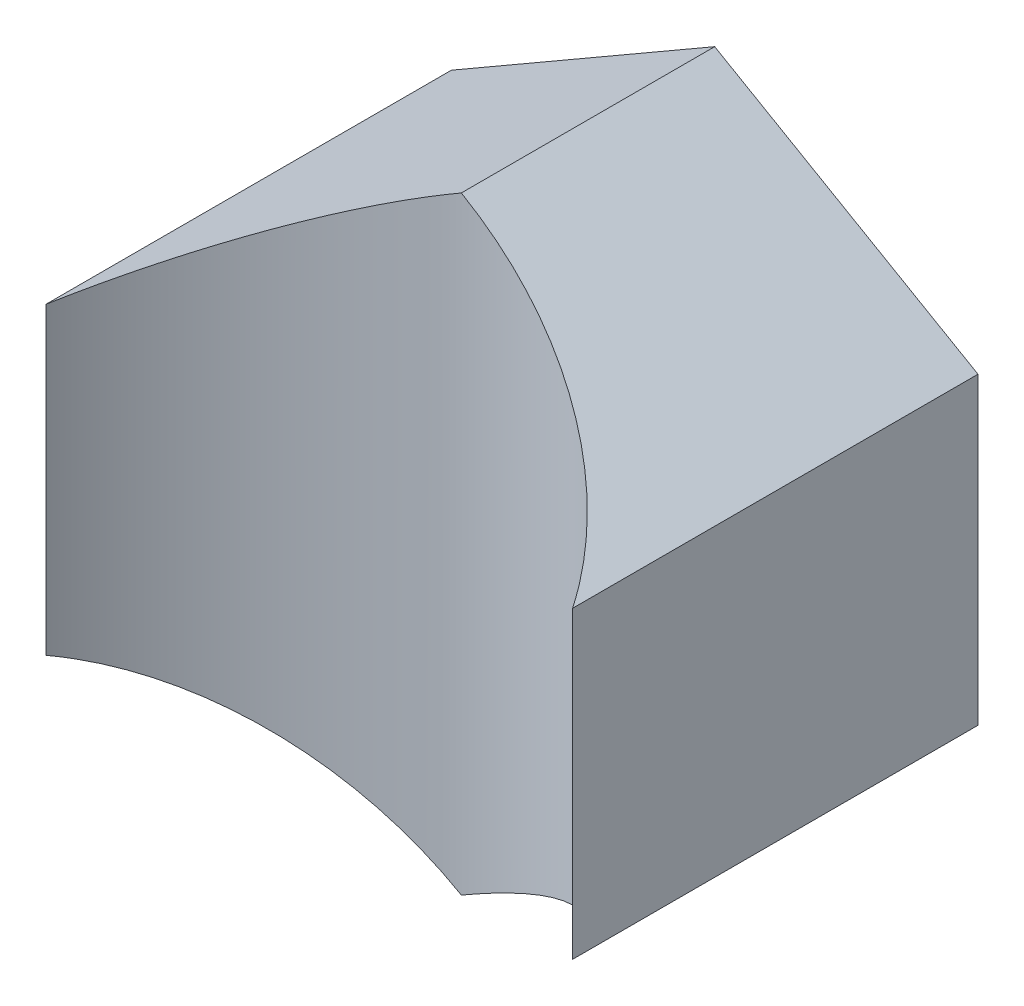
from build123d import *

# Parameters (mm, degrees)
BOSS_EXTRUDE1_DEPTH = 10
SKETCH2_R           = 7.5
CUT_EXTRUDE1_DEPTH  = 13.5


with BuildPart() as part:
    # Sketch1 → Boss-Extrude1 (new body)
    with BuildSketch(Plane.XY):
        Polygon((0, -7.5), (6.495190528, -3.75), (6.495190528, 3.75), (0, 7.5), (-6.495190528, 3.75), (-6.495190528, -3.75), align=None)
    extrude(amount=BOSS_EXTRUDE1_DEPTH)

    # Sketch2 → Cut-Extrude1 (cut, symmetric)
    with BuildSketch(Plane(origin=(0, 0, 0), x_dir=(0, 0, -1), z_dir=(0, 1, 0))):
        with Locations((-13.75, 0)):
            Circle(SKETCH2_R)
    extrude(amount=CUT_EXTRUDE1_DEPTH, both=True, mode=Mode.SUBTRACT)


solid = part.part
